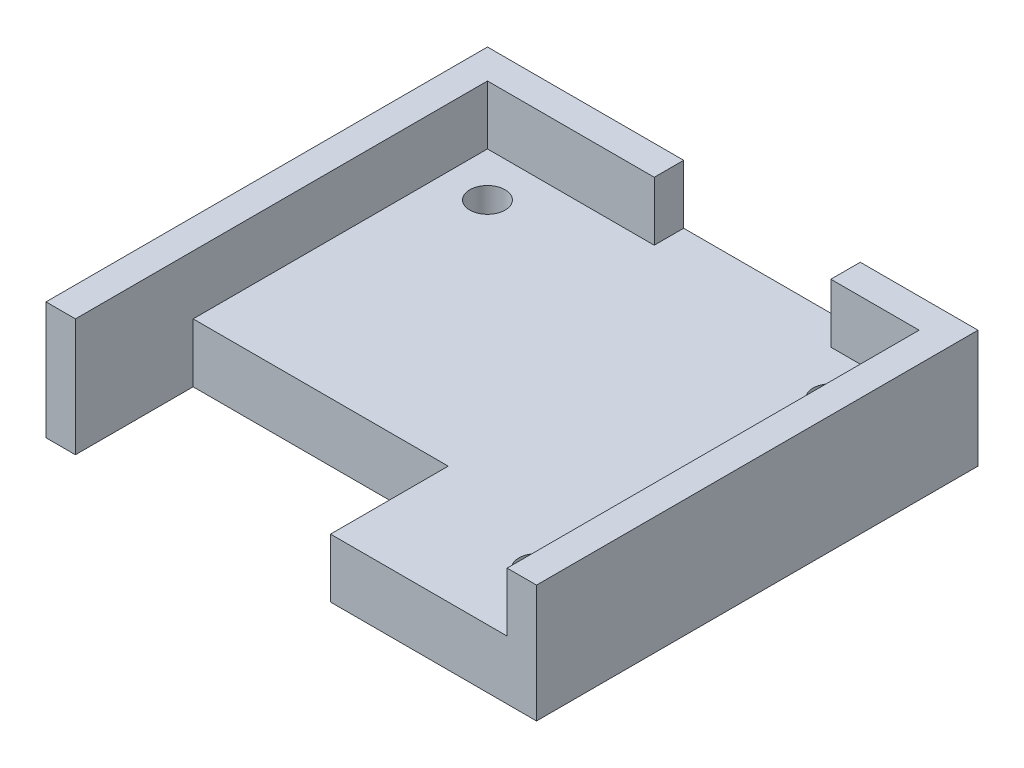
from build123d import *

# Parameters (mm, degrees)
SKETCH_1_W                 = 50
SKETCH_1_H                 = 45
EXTRUDE_1_DEPTH            = 12
SHELL_1_T                  = -3
SHELL_1_THICKNESS_2_FACE_W = 39
SHELL_1_THICKNESS_2_FACE_H = 44
SHELL_1_THICKNESS_2_DEPTH  = 3
HOLE_WIZARD_1_AT_2_COUNT   = 2
HOLE_WIZARD_1_AT_2_PITCH   = 35
HOLE_WIZARD_1_AT_3_COUNT   = 2
HOLE_WIZARD_1_AT_3_PITCH   = 46.097722286
HOLE_WIZARD_1_AT_4_COUNT   = 2
HOLE_WIZARD_1_AT_4_PITCH   = 30
CUT_EXTRUDE_START          = -40
SKETCH_4_W                 = 18
SKETCH_4_H                 = 6
CUT_EXTRUDE_1_DEPTH        = 12
SKETCH_5_W                 = 44
SKETCH_5_H                 = 6
CUT_EXTRUDE_2_DEPTH        = 12
SKETCH_6_W                 = 26
SKETCH_6_H                 = 12
CUT_EXTRUDE_3_DEPTH        = 12


with BuildPart() as part:
    # 草图1 → 凸台-拉伸1 (new body)
    with BuildSketch(Plane(origin=(0, 0, 0), x_dir=(1, 0, 0), z_dir=(0, 1, 0))):
        Rectangle(SKETCH_1_W, SKETCH_1_H)
    extrude(amount=EXTRUDE_1_DEPTH)

    # 抽壳1
    shell_1_openings = [part.faces().sort_by_distance(p)[0] for p in [
        (0, 12, 0),
    ]]
    offset(amount=SHELL_1_T, openings=shell_1_openings, kind=Kind.INTERSECTION)

    # 抽壳1 thickness 2 face (on inner face of the shell) → 抽壳1 thickness 2 (add)
    with BuildSketch(Plane(origin=(0, 3, 0), x_dir=(0, 0, -1), z_dir=(0, -1, 0))):
        Rectangle(SHELL_1_THICKNESS_2_FACE_W, SHELL_1_THICKNESS_2_FACE_H)
    extrude(amount=-SHELL_1_THICKNESS_2_DEPTH)

    # 草图3 → 打孔尺寸(%根据)内六角圆柱头螺钉的类型1 (revolve, cut)
    with BuildSketch(Plane(origin=(-17.5, 0, 15), x_dir=(0, 0, -1), z_dir=(1, 0, 0))):
        Polygon((0, 0), (0, 12), (1.8, 12), (1.8, 3.4), (3, 3.4), (3, 0.025), (3.025, 0), align=None)
    hole_wizard_1 = revolve(axis=Axis((-17.5, -6.35, 15), (0, 1, 0)), mode=Mode.SUBTRACT)

    # 打孔尺寸(%根据)内六角圆柱头螺钉的类型1 at 2: 打孔尺寸(%根据)内六角圆柱头螺钉的类型1 ×2
    with Locations(*[(i * HOLE_WIZARD_1_AT_2_PITCH, 0, 0) for i in range(1, HOLE_WIZARD_1_AT_2_COUNT)]):
        add(hole_wizard_1, mode=Mode.SUBTRACT)

    # 打孔尺寸(%根据)内六角圆柱头螺钉的类型1 at 3: 打孔尺寸(%根据)内六角圆柱头螺钉的类型1 ×2
    with Locations(*[Vector(0.7592566023652966, 0, -0.6507913734559685) * (i * HOLE_WIZARD_1_AT_3_PITCH) for i in range(1, HOLE_WIZARD_1_AT_3_COUNT)]):
        add(hole_wizard_1, mode=Mode.SUBTRACT)

    # 打孔尺寸(%根据)内六角圆柱头螺钉的类型1 at 4: 打孔尺寸(%根据)内六角圆柱头螺钉的类型1 ×2
    with Locations(*[(0, 0, -i * HOLE_WIZARD_1_AT_4_PITCH) for i in range(1, HOLE_WIZARD_1_AT_4_COUNT)]):
        add(hole_wizard_1, mode=Mode.SUBTRACT)

    # 草图4 → 切除-拉伸1 (cut)
    with BuildSketch(Plane.XY.offset(22.5).offset(CUT_EXTRUDE_START)):
        with Locations((4, 9)):
            Rectangle(SKETCH_4_W, SKETCH_4_H)
    extrude(amount=-CUT_EXTRUDE_1_DEPTH, mode=Mode.SUBTRACT)

    # 草图5 → 切除-拉伸2 (cut)
    with BuildSketch(Plane.XY.offset(22.5)):
        with Locations((0, 9)):
            Rectangle(SKETCH_5_W, SKETCH_5_H)
    extrude(amount=-CUT_EXTRUDE_2_DEPTH, mode=Mode.SUBTRACT)

    # 草图6 → 切除-拉伸3 (cut)
    with BuildSketch(Plane(origin=(0, 6, 0), x_dir=(1, 0, 0), z_dir=(0, 1, 0))):
        with Locations((-9, -16.5)):
            Rectangle(SKETCH_6_W, SKETCH_6_H)
    extrude(amount=-CUT_EXTRUDE_3_DEPTH, mode=Mode.SUBTRACT)


solid = part.part
